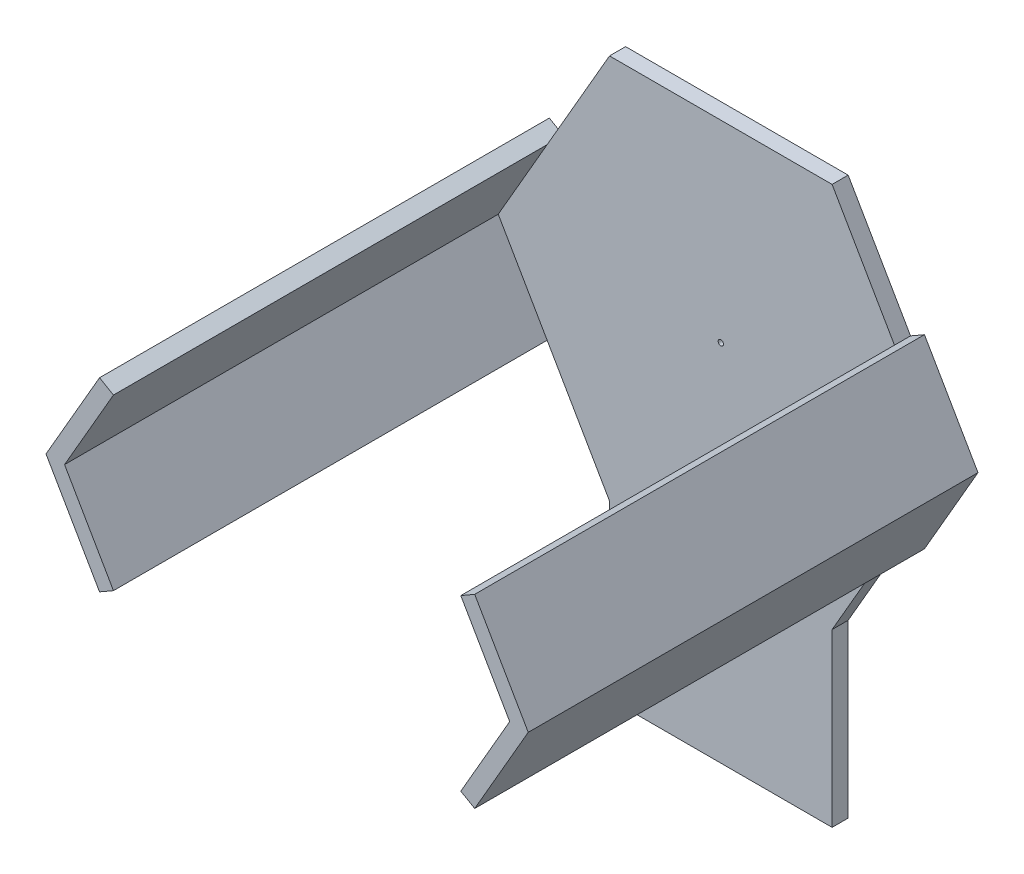
from build123d import *

# Parameters (mm, degrees)
BOSS_EXTRUDE1_DEPTH = 19.05
SKETCH2_W           = 263.964543074
SKETCH2_H           = 203.2
BOSS_EXTRUDE2_DEPTH = 19.05
BOSS_EXTRUDE3_DEPTH = 533.4
SKETCH4_R           = 3.175
CUT_EXTRUDE1_DEPTH  = 730.918620464


with BuildPart() as part:
    # Sketch1 → Boss-Extrude1 (new body)
    with BuildSketch(Plane.XY):
        Polygon((-131.982271537, 228.6), (131.982271537, 228.6), (263.964543073, 0), (131.982271537, -228.6), (-131.982271537, -228.6), (-263.964543073, 0), align=None)
    extrude(amount=BOSS_EXTRUDE1_DEPTH)

    # Sketch2 → Boss-Extrude2 (add)
    with BuildSketch(Plane.XY.offset(19.05)):
        with Locations((0, -330.2)):
            Rectangle(SKETCH2_W, SKETCH2_H)
    extrude(amount=-BOSS_EXTRUDE2_DEPTH)

    # Sketch4 → Cut-Extrude1 (cut, through all)
    with BuildSketch(Plane.XY.offset(19.05)):
        Circle(SKETCH4_R)
        with Locations((0, -320.802)):
            Circle(SKETCH4_R)
    extrude(amount=-CUT_EXTRUDE1_DEPTH, mode=Mode.SUBTRACT)


with BuildPart() as body_2:
    # Sketch3 → Boss-Extrude3 (new body)
    with BuildSketch(Plane(origin=(0, 0, 0), x_dir=(-1, 0, 0), z_dir=(0, 0, -1))):
        Polygon((269.463804388, -9.525), (263.964543073, 0), (205.963804388, -100.460226281), (222.46158833, -109.985226281), (285.96158833, 0), align=None)
        Polygon((269.463804388, 9.525), (263.964543073, 0), (269.463804388, -9.525), (285.96158833, 0), align=None)
        Polygon((222.46158833, 109.985226281), (205.963804388, 100.460226281), (263.964543073, 0), (269.463804388, 9.525), (285.96158833, 0), align=None)
        Polygon((-285.96158833, 0), (-222.46158833, -109.985226281), (-205.963804388, -100.460226281), (-263.964543073, 0), (-269.463804388, -9.525), align=None)
        Polygon((-269.463804388, 9.525), (-285.96158833, 0), (-269.463804388, -9.525), (-263.964543073, 0), align=None)
        Polygon((-222.46158833, 109.985226281), (-285.96158833, 0), (-269.463804388, 9.525), (-263.964543073, 0), (-205.963804388, 100.460226281), align=None)
    extrude(amount=-BOSS_EXTRUDE3_DEPTH)


solid = Compound([part.part, body_2.part])
